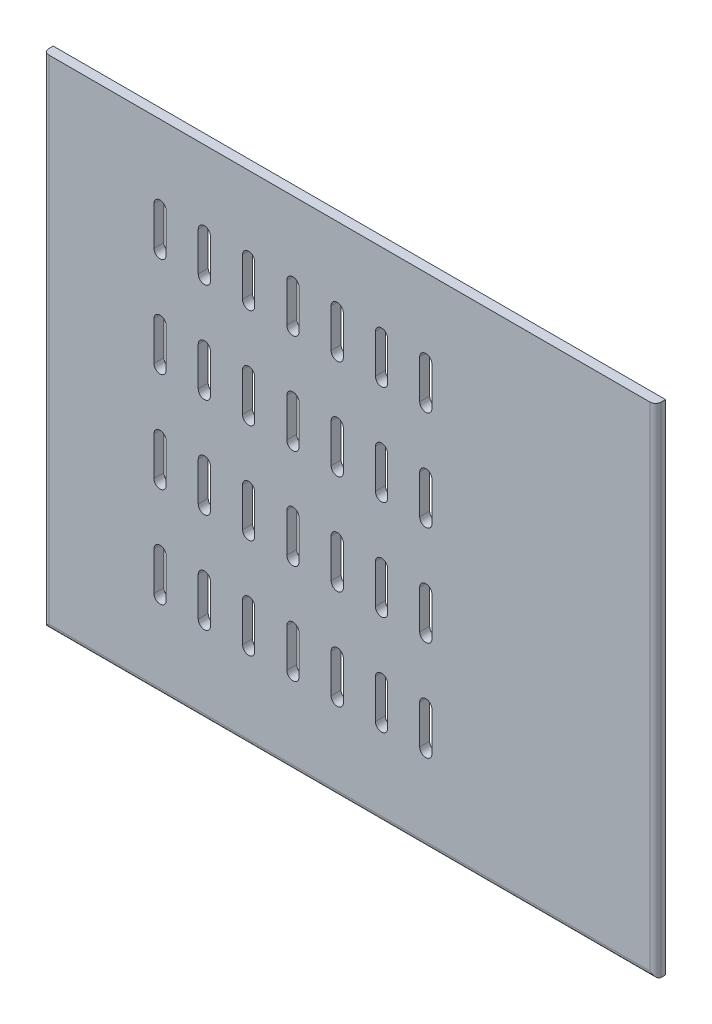
from build123d import *

# Parameters (mm, degrees)
SKETCH_FOR_THE_MAIN_SHAPE_W                    = 110.6
SKETCH_FOR_THE_MAIN_SHAPE_H                    = 90
MAIN_SHAPE_DEPTH                               = 1.8
RAILINGS_FOR_THE_PCB_DEPTH                     = 80
PATTERN_THE_THE_RAILINGS_COUNT                 = 4
PATTERN_THE_THE_RAILINGS_PITCH                 = 18
AIR_VENTS_DEPTH                                = 1.8
PATTERN_ALONG_X_AXIS_FOR_THE_VENT_COUNT        = 7
PATTERN_ALONG_X_AXIS_FOR_THE_VENT_PITCH        = 8
PATTERN_ALONG_Y_AXIS_FOR_THE_VENT_COUNT        = 4
PATTERN_ALONG_Y_AXIS_FOR_THE_VENT_PITCH        = 18
PATTERN_ALONG_Y_AXIS_FOR_THE_VENT_CO_2_DEPTH   = 1.8
PATTERN_ALONG_Y_AXIS_FOR_THE_VENT_CO_3_DEPTH   = 1.8
PATTERN_ALONG_Y_AXIS_FOR_THE_VENT_CO_4_DEPTH   = 1.8
PATTERN_ALONG_Y_AXIS_FOR_THE_VENT_CO_5_DEPTH   = 1.8
PATTERN_ALONG_Y_AXIS_FOR_THE_VENT_CO_6_DEPTH   = 1.8
PATTERN_ALONG_Y_AXIS_FOR_THE_VENT_CO_7_DEPTH   = 1.8
PATTERN_ALONG_Y_AXIS_FOR_THE_VENT_CO_8_DEPTH   = 1.8
PATTERN_ALONG_Y_AXIS_FOR_THE_VENT_CO_9_DEPTH   = 1.8
PATTERN_ALONG_Y_AXIS_FOR_THE_VENT_CO_10_DEPTH  = 1.8
PATTERN_ALONG_Y_AXIS_FOR_THE_VENT_CO_12_DEPTH  = 1.8
PATTERN_ALONG_Y_AXIS_FOR_THE_VENT_CO_14_DEPTH  = 1.8
PATTERN_ALONG_Y_AXIS_FOR_THE_VENT_CO_16_DEPTH  = 1.8
PATTERN_ALONG_Y_AXIS_FOR_THE_VENT_CO_18_DEPTH  = 1.8
PATTERN_ALONG_Y_AXIS_FOR_THE_VENT_CO_20_DEPTH  = 1.8
PATTERN_ALONG_Y_AXIS_FOR_THE_VENT_CO_22_DEPTH  = 1.8
PATTERN_ALONG_Y_AXIS_FOR_THE_VENT_CO_24_DEPTH  = 1.8
PATTERN_ALONG_Y_AXIS_FOR_THE_VENT_CO_26_DEPTH  = 1.8
PATTERN_ALONG_Y_AXIS_FOR_THE_VENT_CO_28_DEPTH  = 1.8
SMALL_GAP_BETWEEN_THE_EDGE_AND_THE_RAILI_DEPTH = 2
PATTERN_FOR_TH_SMALL_GAP_COUNT                 = 4
PATTERN_FOR_TH_SMALL_GAP_PITCH                 = 18
FILLETS_R                                      = 1


with BuildPart() as part:
    # Sketch for the main shape → Main Shape (new body)
    with BuildSketch(Plane.XY):
        with Locations((55.3, 45)):
            Rectangle(SKETCH_FOR_THE_MAIN_SHAPE_W, SKETCH_FOR_THE_MAIN_SHAPE_H)
    extrude(amount=MAIN_SHAPE_DEPTH)

    # Sketch for the railings → Railings for the PCB (add)
    with BuildSketch(Plane(origin=(0, 0, 0), x_dir=(0, 0, -1), z_dir=(1, 0, 0))):
        Polygon((0, 10.9), (3, 10.9), (0, 8.254248689), align=None)
    railings_for_the_pcb = extrude(amount=RAILINGS_FOR_THE_PCB_DEPTH)

    # Pattern the the railings: Railings for the PCB ×4
    with Locations(*[(0, i * PATTERN_THE_THE_RAILINGS_PITCH, 0) for i in range(1, PATTERN_THE_THE_RAILINGS_COUNT)]):
        add(railings_for_the_pcb)

    # Sketch for the air vents → Air vents (cut)
    with BuildSketch(Plane(origin=(0, 0, 0), x_dir=(-1, 0, 0), z_dir=(0, 0, -1))):
        with BuildLine():
            Line((-20, 22.254248689), (-20, 15.254248689))
            ThreePointArc((-20, 15.254248689), (-21.101269167, 14.152979522), (-22.202538334, 15.254248689))
            Line((-22.202538334, 15.254248689), (-22.202538334, 22.254248689))
            ThreePointArc((-22.202538334, 22.254248689), (-21.101269167, 23.355517856), (-20, 22.254248689))
        make_face()
    air_vents = extrude(amount=-AIR_VENTS_DEPTH, mode=Mode.SUBTRACT)

    # pattern along x axis for the vent: Air vents ×7
    with Locations(*[(i * PATTERN_ALONG_X_AXIS_FOR_THE_VENT_PITCH, 0, 0) for i in range(1, PATTERN_ALONG_X_AXIS_FOR_THE_VENT_COUNT)]):
        add(air_vents, mode=Mode.SUBTRACT)

    # pattern along y axis for the vent: Air vents ×4
    with Locations(*[(0, i * PATTERN_ALONG_Y_AXIS_FOR_THE_VENT_PITCH, 0) for i in range(1, PATTERN_ALONG_Y_AXIS_FOR_THE_VENT_COUNT)]):
        add(air_vents, mode=Mode.SUBTRACT)

    # pattern along y axis for the vent copy 1 → pattern along y axis for the vent co 2 (cut)
    with BuildSketch(Plane(origin=(8, 18, 0), x_dir=(-1, 0, 0), z_dir=(0, 0, -1))):
        with BuildLine():
            Line((-20, 22.254248689), (-20, 15.254248689))
            ThreePointArc((-20, 15.254248689), (-21.101269167, 14.152979522), (-22.202538334, 15.254248689))
            Line((-22.202538334, 15.254248689), (-22.202538334, 22.254248689))
            ThreePointArc((-22.202538334, 22.254248689), (-21.101269167, 23.355517856), (-20, 22.254248689))
        make_face()
    extrude(amount=-PATTERN_ALONG_Y_AXIS_FOR_THE_VENT_CO_2_DEPTH, mode=Mode.SUBTRACT)

    # pattern along y axis for the vent copy 2 → pattern along y axis for the vent co 3 (cut)
    with BuildSketch(Plane(origin=(8, 36, 0), x_dir=(-1, 0, 0), z_dir=(0, 0, -1))):
        with BuildLine():
            Line((-20, 22.254248689), (-20, 15.254248689))
            ThreePointArc((-20, 15.254248689), (-21.101269167, 14.152979522), (-22.202538334, 15.254248689))
            Line((-22.202538334, 15.254248689), (-22.202538334, 22.254248689))
            ThreePointArc((-22.202538334, 22.254248689), (-21.101269167, 23.355517856), (-20, 22.254248689))
        make_face()
    extrude(amount=-PATTERN_ALONG_Y_AXIS_FOR_THE_VENT_CO_3_DEPTH, mode=Mode.SUBTRACT)

    # pattern along y axis for the vent copy 3 → pattern along y axis for the vent co 4 (cut)
    with BuildSketch(Plane(origin=(8, 54, 0), x_dir=(-1, 0, 0), z_dir=(0, 0, -1))):
        with BuildLine():
            Line((-20, 22.254248689), (-20, 15.254248689))
            ThreePointArc((-20, 15.254248689), (-21.101269167, 14.152979522), (-22.202538334, 15.254248689))
            Line((-22.202538334, 15.254248689), (-22.202538334, 22.254248689))
            ThreePointArc((-22.202538334, 22.254248689), (-21.101269167, 23.355517856), (-20, 22.254248689))
        make_face()
    extrude(amount=-PATTERN_ALONG_Y_AXIS_FOR_THE_VENT_CO_4_DEPTH, mode=Mode.SUBTRACT)

    # pattern along y axis for the vent copy 4 → pattern along y axis for the vent co 5 (cut)
    with BuildSketch(Plane(origin=(16, 18, 0), x_dir=(-1, 0, 0), z_dir=(0, 0, -1))):
        with BuildLine():
            Line((-20, 22.254248689), (-20, 15.254248689))
            ThreePointArc((-20, 15.254248689), (-21.101269167, 14.152979522), (-22.202538334, 15.254248689))
            Line((-22.202538334, 15.254248689), (-22.202538334, 22.254248689))
            ThreePointArc((-22.202538334, 22.254248689), (-21.101269167, 23.355517856), (-20, 22.254248689))
        make_face()
    extrude(amount=-PATTERN_ALONG_Y_AXIS_FOR_THE_VENT_CO_5_DEPTH, mode=Mode.SUBTRACT)

    # pattern along y axis for the vent copy 5 → pattern along y axis for the vent co 6 (cut)
    with BuildSketch(Plane(origin=(16, 36, 0), x_dir=(-1, 0, 0), z_dir=(0, 0, -1))):
        with BuildLine():
            Line((-20, 22.254248689), (-20, 15.254248689))
            ThreePointArc((-20, 15.254248689), (-21.101269167, 14.152979522), (-22.202538334, 15.254248689))
            Line((-22.202538334, 15.254248689), (-22.202538334, 22.254248689))
            ThreePointArc((-22.202538334, 22.254248689), (-21.101269167, 23.355517856), (-20, 22.254248689))
        make_face()
    extrude(amount=-PATTERN_ALONG_Y_AXIS_FOR_THE_VENT_CO_6_DEPTH, mode=Mode.SUBTRACT)

    # pattern along y axis for the vent copy 6 → pattern along y axis for the vent co 7 (cut)
    with BuildSketch(Plane(origin=(16, 54, 0), x_dir=(-1, 0, 0), z_dir=(0, 0, -1))):
        with BuildLine():
            Line((-20, 22.254248689), (-20, 15.254248689))
            ThreePointArc((-20, 15.254248689), (-21.101269167, 14.152979522), (-22.202538334, 15.254248689))
            Line((-22.202538334, 15.254248689), (-22.202538334, 22.254248689))
            ThreePointArc((-22.202538334, 22.254248689), (-21.101269167, 23.355517856), (-20, 22.254248689))
        make_face()
    extrude(amount=-PATTERN_ALONG_Y_AXIS_FOR_THE_VENT_CO_7_DEPTH, mode=Mode.SUBTRACT)

    # pattern along y axis for the vent copy 7 → pattern along y axis for the vent co 8 (cut)
    with BuildSketch(Plane(origin=(24, 18, 0), x_dir=(-1, 0, 0), z_dir=(0, 0, -1))):
        with BuildLine():
            Line((-20, 22.254248689), (-20, 15.254248689))
            ThreePointArc((-20, 15.254248689), (-21.101269167, 14.152979522), (-22.202538334, 15.254248689))
            Line((-22.202538334, 15.254248689), (-22.202538334, 22.254248689))
            ThreePointArc((-22.202538334, 22.254248689), (-21.101269167, 23.355517856), (-20, 22.254248689))
        make_face()
    extrude(amount=-PATTERN_ALONG_Y_AXIS_FOR_THE_VENT_CO_8_DEPTH, mode=Mode.SUBTRACT)

    # pattern along y axis for the vent copy 8 → pattern along y axis for the vent co 9 (cut)
    with BuildSketch(Plane(origin=(24, 36, 0), x_dir=(-1, 0, 0), z_dir=(0, 0, -1))):
        with BuildLine():
            Line((-20, 22.254248689), (-20, 15.254248689))
            ThreePointArc((-20, 15.254248689), (-21.101269167, 14.152979522), (-22.202538334, 15.254248689))
            Line((-22.202538334, 15.254248689), (-22.202538334, 22.254248689))
            ThreePointArc((-22.202538334, 22.254248689), (-21.101269167, 23.355517856), (-20, 22.254248689))
        make_face()
    extrude(amount=-PATTERN_ALONG_Y_AXIS_FOR_THE_VENT_CO_9_DEPTH, mode=Mode.SUBTRACT)

    # pattern along y axis for the vent copy 9 → pattern along y axis for the vent co 10 (cut)
    with BuildSketch(Plane(origin=(24, 54, 0), x_dir=(-1, 0, 0), z_dir=(0, 0, -1))):
        with BuildLine():
            Line((-20, 22.254248689), (-20, 15.254248689))
            ThreePointArc((-20, 15.254248689), (-21.101269167, 14.152979522), (-22.202538334, 15.254248689))
            Line((-22.202538334, 15.254248689), (-22.202538334, 22.254248689))
            ThreePointArc((-22.202538334, 22.254248689), (-21.101269167, 23.355517856), (-20, 22.254248689))
        make_face()
    extrude(amount=-PATTERN_ALONG_Y_AXIS_FOR_THE_VENT_CO_10_DEPTH, mode=Mode.SUBTRACT)

    # pattern along y axis for the vent co 11 → pattern along y axis for the vent co 12 (cut)
    with BuildSketch(Plane(origin=(32, 18, 0), x_dir=(-1, 0, 0), z_dir=(0, 0, -1))):
        with BuildLine():
            Line((-20, 22.254248689), (-20, 15.254248689))
            ThreePointArc((-20, 15.254248689), (-21.101269167, 14.152979522), (-22.202538334, 15.254248689))
            Line((-22.202538334, 15.254248689), (-22.202538334, 22.254248689))
            ThreePointArc((-22.202538334, 22.254248689), (-21.101269167, 23.355517856), (-20, 22.254248689))
        make_face()
    extrude(amount=-PATTERN_ALONG_Y_AXIS_FOR_THE_VENT_CO_12_DEPTH, mode=Mode.SUBTRACT)

    # pattern along y axis for the vent co 13 → pattern along y axis for the vent co 14 (cut)
    with BuildSketch(Plane(origin=(32, 36, 0), x_dir=(-1, 0, 0), z_dir=(0, 0, -1))):
        with BuildLine():
            Line((-20, 22.254248689), (-20, 15.254248689))
            ThreePointArc((-20, 15.254248689), (-21.101269167, 14.152979522), (-22.202538334, 15.254248689))
            Line((-22.202538334, 15.254248689), (-22.202538334, 22.254248689))
            ThreePointArc((-22.202538334, 22.254248689), (-21.101269167, 23.355517856), (-20, 22.254248689))
        make_face()
    extrude(amount=-PATTERN_ALONG_Y_AXIS_FOR_THE_VENT_CO_14_DEPTH, mode=Mode.SUBTRACT)

    # pattern along y axis for the vent co 15 → pattern along y axis for the vent co 16 (cut)
    with BuildSketch(Plane(origin=(32, 54, 0), x_dir=(-1, 0, 0), z_dir=(0, 0, -1))):
        with BuildLine():
            Line((-20, 22.254248689), (-20, 15.254248689))
            ThreePointArc((-20, 15.254248689), (-21.101269167, 14.152979522), (-22.202538334, 15.254248689))
            Line((-22.202538334, 15.254248689), (-22.202538334, 22.254248689))
            ThreePointArc((-22.202538334, 22.254248689), (-21.101269167, 23.355517856), (-20, 22.254248689))
        make_face()
    extrude(amount=-PATTERN_ALONG_Y_AXIS_FOR_THE_VENT_CO_16_DEPTH, mode=Mode.SUBTRACT)

    # pattern along y axis for the vent co 17 → pattern along y axis for the vent co 18 (cut)
    with BuildSketch(Plane(origin=(40, 18, 0), x_dir=(-1, 0, 0), z_dir=(0, 0, -1))):
        with BuildLine():
            Line((-20, 22.254248689), (-20, 15.254248689))
            ThreePointArc((-20, 15.254248689), (-21.101269167, 14.152979522), (-22.202538334, 15.254248689))
            Line((-22.202538334, 15.254248689), (-22.202538334, 22.254248689))
            ThreePointArc((-22.202538334, 22.254248689), (-21.101269167, 23.355517856), (-20, 22.254248689))
        make_face()
    extrude(amount=-PATTERN_ALONG_Y_AXIS_FOR_THE_VENT_CO_18_DEPTH, mode=Mode.SUBTRACT)

    # pattern along y axis for the vent co 19 → pattern along y axis for the vent co 20 (cut)
    with BuildSketch(Plane(origin=(40, 36, 0), x_dir=(-1, 0, 0), z_dir=(0, 0, -1))):
        with BuildLine():
            Line((-20, 22.254248689), (-20, 15.254248689))
            ThreePointArc((-20, 15.254248689), (-21.101269167, 14.152979522), (-22.202538334, 15.254248689))
            Line((-22.202538334, 15.254248689), (-22.202538334, 22.254248689))
            ThreePointArc((-22.202538334, 22.254248689), (-21.101269167, 23.355517856), (-20, 22.254248689))
        make_face()
    extrude(amount=-PATTERN_ALONG_Y_AXIS_FOR_THE_VENT_CO_20_DEPTH, mode=Mode.SUBTRACT)

    # pattern along y axis for the vent co 21 → pattern along y axis for the vent co 22 (cut)
    with BuildSketch(Plane(origin=(40, 54, 0), x_dir=(-1, 0, 0), z_dir=(0, 0, -1))):
        with BuildLine():
            Line((-20, 22.254248689), (-20, 15.254248689))
            ThreePointArc((-20, 15.254248689), (-21.101269167, 14.152979522), (-22.202538334, 15.254248689))
            Line((-22.202538334, 15.254248689), (-22.202538334, 22.254248689))
            ThreePointArc((-22.202538334, 22.254248689), (-21.101269167, 23.355517856), (-20, 22.254248689))
        make_face()
    extrude(amount=-PATTERN_ALONG_Y_AXIS_FOR_THE_VENT_CO_22_DEPTH, mode=Mode.SUBTRACT)

    # pattern along y axis for the vent co 23 → pattern along y axis for the vent co 24 (cut)
    with BuildSketch(Plane(origin=(48, 18, 0), x_dir=(-1, 0, 0), z_dir=(0, 0, -1))):
        with BuildLine():
            Line((-20, 22.254248689), (-20, 15.254248689))
            ThreePointArc((-20, 15.254248689), (-21.101269167, 14.152979522), (-22.202538334, 15.254248689))
            Line((-22.202538334, 15.254248689), (-22.202538334, 22.254248689))
            ThreePointArc((-22.202538334, 22.254248689), (-21.101269167, 23.355517856), (-20, 22.254248689))
        make_face()
    extrude(amount=-PATTERN_ALONG_Y_AXIS_FOR_THE_VENT_CO_24_DEPTH, mode=Mode.SUBTRACT)

    # pattern along y axis for the vent co 25 → pattern along y axis for the vent co 26 (cut)
    with BuildSketch(Plane(origin=(48, 36, 0), x_dir=(-1, 0, 0), z_dir=(0, 0, -1))):
        with BuildLine():
            Line((-20, 22.254248689), (-20, 15.254248689))
            ThreePointArc((-20, 15.254248689), (-21.101269167, 14.152979522), (-22.202538334, 15.254248689))
            Line((-22.202538334, 15.254248689), (-22.202538334, 22.254248689))
            ThreePointArc((-22.202538334, 22.254248689), (-21.101269167, 23.355517856), (-20, 22.254248689))
        make_face()
    extrude(amount=-PATTERN_ALONG_Y_AXIS_FOR_THE_VENT_CO_26_DEPTH, mode=Mode.SUBTRACT)

    # pattern along y axis for the vent co 27 → pattern along y axis for the vent co 28 (cut)
    with BuildSketch(Plane(origin=(48, 54, 0), x_dir=(-1, 0, 0), z_dir=(0, 0, -1))):
        with BuildLine():
            Line((-20, 22.254248689), (-20, 15.254248689))
            ThreePointArc((-20, 15.254248689), (-21.101269167, 14.152979522), (-22.202538334, 15.254248689))
            Line((-22.202538334, 15.254248689), (-22.202538334, 22.254248689))
            ThreePointArc((-22.202538334, 22.254248689), (-21.101269167, 23.355517856), (-20, 22.254248689))
        make_face()
    extrude(amount=-PATTERN_ALONG_Y_AXIS_FOR_THE_VENT_CO_28_DEPTH, mode=Mode.SUBTRACT)

    # Sketch for the small gap between the edge and the railing → small gap between the edge and the raili (cut)
    with BuildSketch(Plane.ZY):
        Polygon((0, 8.254248689), (-3, 10.9), (0, 10.9), align=None)
    small_gap_between_the_edge_and_the_raili = extrude(amount=-SMALL_GAP_BETWEEN_THE_EDGE_AND_THE_RAILI_DEPTH, mode=Mode.SUBTRACT)

    # pattern for th small gap: small gap between the edge and the raili ×4
    with Locations(*[(0, i * PATTERN_FOR_TH_SMALL_GAP_PITCH, 0) for i in range(1, PATTERN_FOR_TH_SMALL_GAP_COUNT)]):
        add(small_gap_between_the_edge_and_the_raili, mode=Mode.SUBTRACT)

    # Fillets
    fillets_edges = [part.edges().sort_by_distance(p)[0] for p in [
        (110.6, 45, 1.8),
        (0, 45, 1.8),
        (55.3, 0, 1.8),
    ]]
    fillet(fillets_edges, radius=FILLETS_R)


solid = part.part
